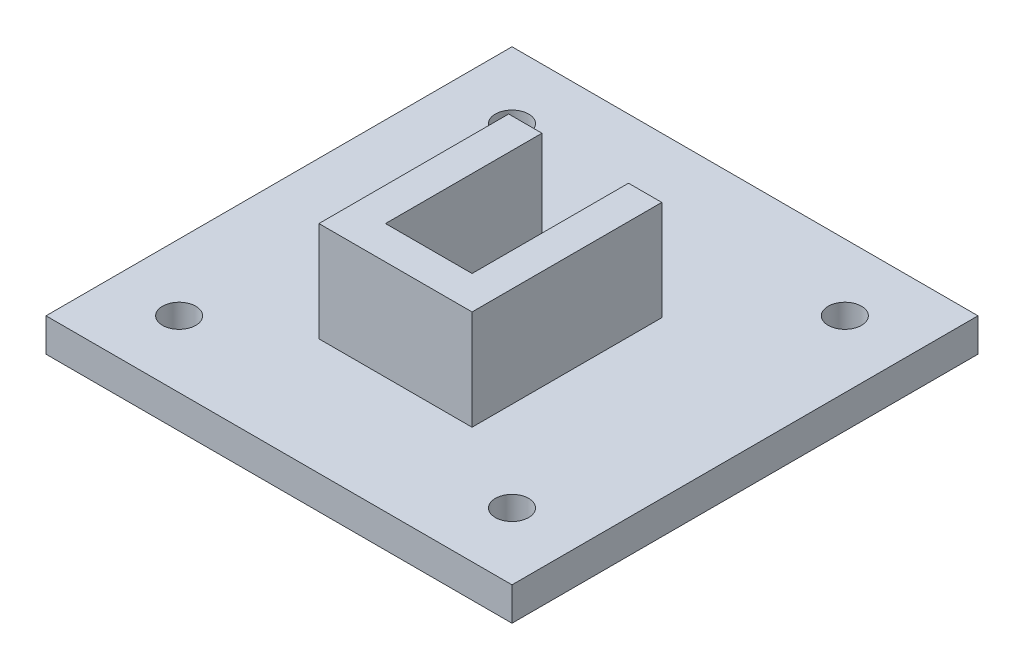
from build123d import *

# Parameters (mm, degrees)
SKETCH1_W           = 70
SKETCH1_H           = 70
BOSS_EXTRUDE1_DEPTH = 5
SKETCH2_R           = 2.5
CUT_EXTRUDE1_DEPTH  = 5
SKETCH3_R           = 2.5
CUT_EXTRUDE2_DEPTH  = 5
SKETCH4_R           = 2.5
CUT_EXTRUDE3_DEPTH  = 5
SKETCH5_R           = 2.5
CUT_EXTRUDE4_DEPTH  = 5
SKETCH6_W           = 23
SKETCH6_H           = 35
BOSS_EXTRUDE2_DEPTH = 15
SKETCH7_W           = 13
SKETCH7_H           = 30
CUT_EXTRUDE5_DEPTH  = 15
SKETCH8_W           = 5
SKETCH8_H           = 6.5
CUT_EXTRUDE6_DEPTH  = 15
SKETCH9_W           = 5
SKETCH9_H           = 6.5
CUT_EXTRUDE7_DEPTH  = 15


with BuildPart() as part:
    # Sketch1 → Boss-Extrude1 (new body)
    with BuildSketch(Plane(origin=(0, 0, 0), x_dir=(1, 0, 0), z_dir=(0, 1, 0))):
        Rectangle(SKETCH1_W, SKETCH1_H)
    extrude(amount=BOSS_EXTRUDE1_DEPTH)

    # Sketch2 → Cut-Extrude1 (cut)
    with BuildSketch(Plane(origin=(0, 5, 0), x_dir=(1, 0, 0), z_dir=(0, 1, 0))):
        with Locations(Location((-25, 25, 0), (0, 0, 270))):
            Circle(SKETCH2_R)
    extrude(amount=-CUT_EXTRUDE1_DEPTH, mode=Mode.SUBTRACT)

    # Sketch3 → Cut-Extrude2 (cut)
    with BuildSketch(Plane(origin=(0, 5, 0), x_dir=(1, 0, 0), z_dir=(0, 1, 0))):
        with Locations(Location((25, 25, 0), (0, 0, 270))):
            Circle(SKETCH3_R)
    extrude(amount=-CUT_EXTRUDE2_DEPTH, mode=Mode.SUBTRACT)

    # Sketch4 → Cut-Extrude3 (cut)
    with BuildSketch(Plane(origin=(0, 5, 0), x_dir=(1, 0, 0), z_dir=(0, 1, 0))):
        with Locations(Location((-25, -25, 0), (0, 0, 270))):
            Circle(SKETCH4_R)
    extrude(amount=-CUT_EXTRUDE3_DEPTH, mode=Mode.SUBTRACT)

    # Sketch5 → Cut-Extrude4 (cut)
    with BuildSketch(Plane(origin=(0, 5, 0), x_dir=(1, 0, 0), z_dir=(0, 1, 0))):
        with Locations(Location((25, -25, 0), (0, 0, 270))):
            Circle(SKETCH5_R)
    extrude(amount=-CUT_EXTRUDE4_DEPTH, mode=Mode.SUBTRACT)

    # Sketch6 → Boss-Extrude2 (add)
    with BuildSketch(Plane(origin=(0, 5, 0), x_dir=(1, 0, 0), z_dir=(0, 1, 0))):
        Rectangle(SKETCH6_W, SKETCH6_H)
    extrude(amount=BOSS_EXTRUDE2_DEPTH)

    # Sketch7 → Cut-Extrude5 (cut)
    with BuildSketch(Plane(origin=(0, 20, 0), x_dir=(1, 0, 0), z_dir=(0, 1, 0))):
        with Locations((0, 2.5)):
            Rectangle(SKETCH7_W, SKETCH7_H)
    extrude(amount=-CUT_EXTRUDE5_DEPTH, mode=Mode.SUBTRACT)

    # Sketch8 → Cut-Extrude6 (cut)
    with BuildSketch(Plane(origin=(0, 20, 0), x_dir=(1, 0, 0), z_dir=(0, 1, 0))):
        with Locations((-9, 14.25)):
            Rectangle(SKETCH8_W, SKETCH8_H)
    extrude(amount=-CUT_EXTRUDE6_DEPTH, mode=Mode.SUBTRACT)

    # Sketch9 → Cut-Extrude7 (cut)
    with BuildSketch(Plane(origin=(0, 20, 0), x_dir=(1, 0, 0), z_dir=(0, 1, 0))):
        with Locations((9, 14.25)):
            Rectangle(SKETCH9_W, SKETCH9_H)
    extrude(amount=-CUT_EXTRUDE7_DEPTH, mode=Mode.SUBTRACT)


solid = part.part
